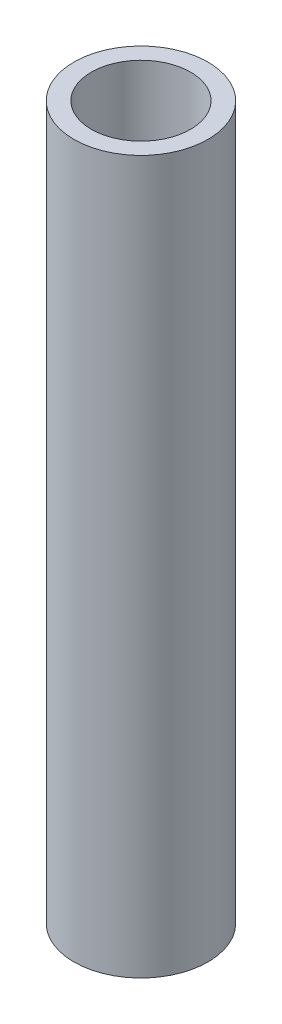
from build123d import *

# Parameters (mm, degrees)
SKETCH1_R           = 12.7
SKETCH1_R_2         = 9.398
BOSS_EXTRUDE1_DEPTH = 135


with BuildPart() as part:
    # Sketch1 → Boss-Extrude1 (new body)
    with BuildSketch(Plane(origin=(0, 0, 0), x_dir=(1, 0, 0), z_dir=(0, 1, 0))):
        with Locations(Location((0, 0, 0), (0, 0, 270))):
            Circle(SKETCH1_R)
        with Locations(Location((0, 0, 0), (0, 0, 270))):
            Circle(SKETCH1_R_2, mode=Mode.SUBTRACT)
    extrude(amount=BOSS_EXTRUDE1_DEPTH)


solid = part.part
